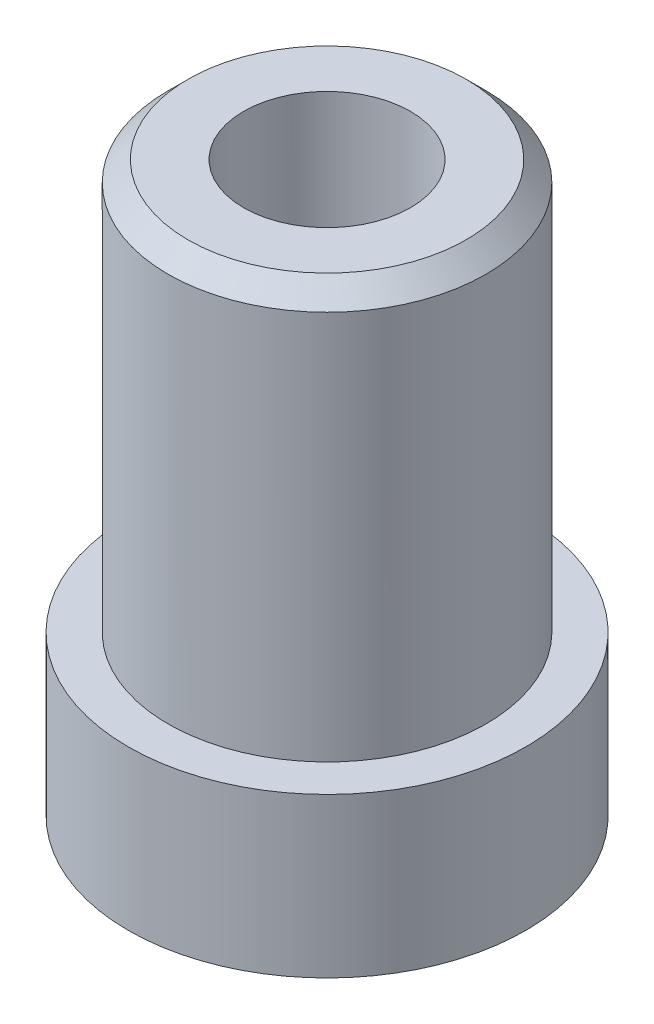
from build123d import *

# Parameters (mm, degrees)
SKETCH_1_R             = 4
EXTRUDE_1_DEPTH        = 7.15
SKETCH_2_W             = 1
SKETCH_2_H             = 4
CHAMFER_1_SIZE         = 0.5
HOLE_WIZARD_M5_1_D     = 4.2
HOLE_WIZARD_M5_1_DEPTH = 17.4
HOLE_WIZARD_M5_1_TIP   = 1.2618073


with BuildPart() as part:
    # 草图1 → 凸台-拉伸1 (new, symmetric)
    with BuildSketch(Plane(origin=(0, 0, 0), x_dir=(1, 0, 0), z_dir=(0, 1, 0))):
        with Locations(Location((0, 0, 0), (0, 0, 270))):
            Circle(SKETCH_1_R)
    extrude(amount=EXTRUDE_1_DEPTH, both=True)

    # 草图2 → 旋转1 (revolve)
    with BuildSketch(Plane.XY, mode=Mode.PRIVATE) as revolve_1_sk:
        with Locations((4.5, -5.15)):
            Rectangle(SKETCH_2_W, SKETCH_2_H)
    revolve(revolve_1_sk.sketch.rotate(Axis((0, 7.15, 0), (0, -1, 0)), 270), axis=Axis((0, 7.15, 0), (0, -1, 0)))

    # 倒角1
    chamfer_1_edges = [part.edges().sort_by_distance(p)[0] for p in [
        (0, 7.15, -4),
    ]]
    chamfer(chamfer_1_edges, length=CHAMFER_1_SIZE)

    # M5 螺纹孔1
    with Locations(Plane(origin=(0, -7.15, 0), x_dir=(-1, 0, 0), z_dir=(0, -1, 0))):
        with Locations((0, 0)):
            Hole(HOLE_WIZARD_M5_1_D / 2, depth=HOLE_WIZARD_M5_1_DEPTH)
            with Locations((0, 0, -(HOLE_WIZARD_M5_1_DEPTH + HOLE_WIZARD_M5_1_TIP / 2))):  # 118° drill point
                Cone(0, HOLE_WIZARD_M5_1_D / 2, HOLE_WIZARD_M5_1_TIP, mode=Mode.SUBTRACT)


solid = part.part
